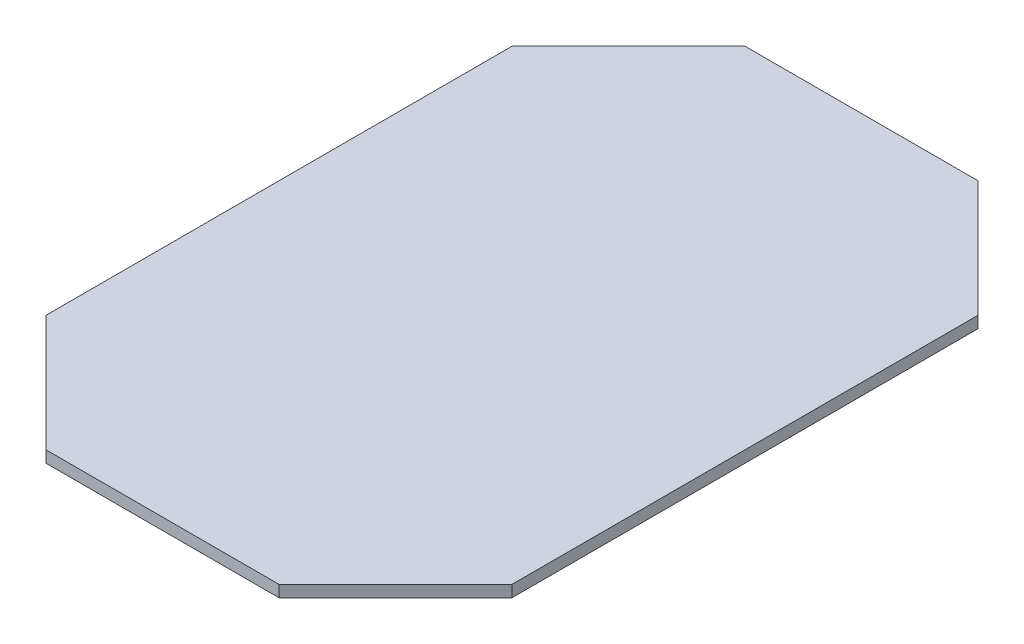
from build123d import *

# Parameters (mm, degrees)
BOSS_EXTRUDE1_DEPTH = 2


with BuildPart() as part:
    # Sketch1 → Boss-Extrude1 (new body)
    with BuildSketch(Plane(origin=(0, 0, 0), x_dir=(1, 0, 0), z_dir=(0, 1, 0))):
        Polygon((-20, 60), (-40, 40), (-40, -40), (-20, -60), (20, -60), (40, -40), (40, 40), (20, 60), align=None)
    extrude(amount=BOSS_EXTRUDE1_DEPTH)


solid = part.part
